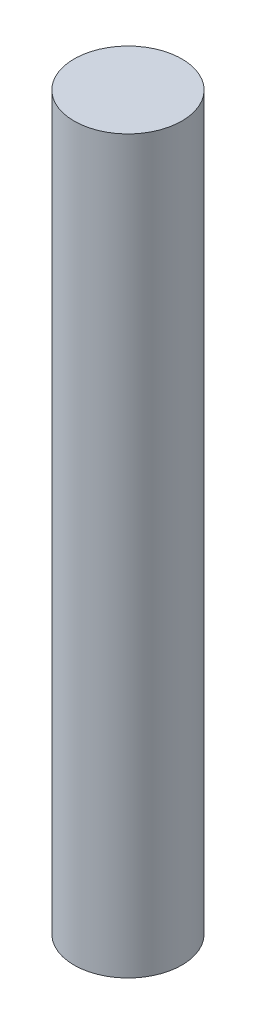
from build123d import *

# Parameters (mm, degrees)
SKETCH_1_R      = 1.4
EXTRUDE_1_DEPTH = 19


with BuildPart() as part:
    # 草图1 → 凸台-拉伸1 (new body)
    with BuildSketch(Plane(origin=(0, 0, 0), x_dir=(1, 0, 0), z_dir=(0, 1, 0))):
        with Locations(Location((0, 0, 0), (0, 0, 270))):
            Circle(SKETCH_1_R)
    extrude(amount=EXTRUDE_1_DEPTH)


solid = part.part
